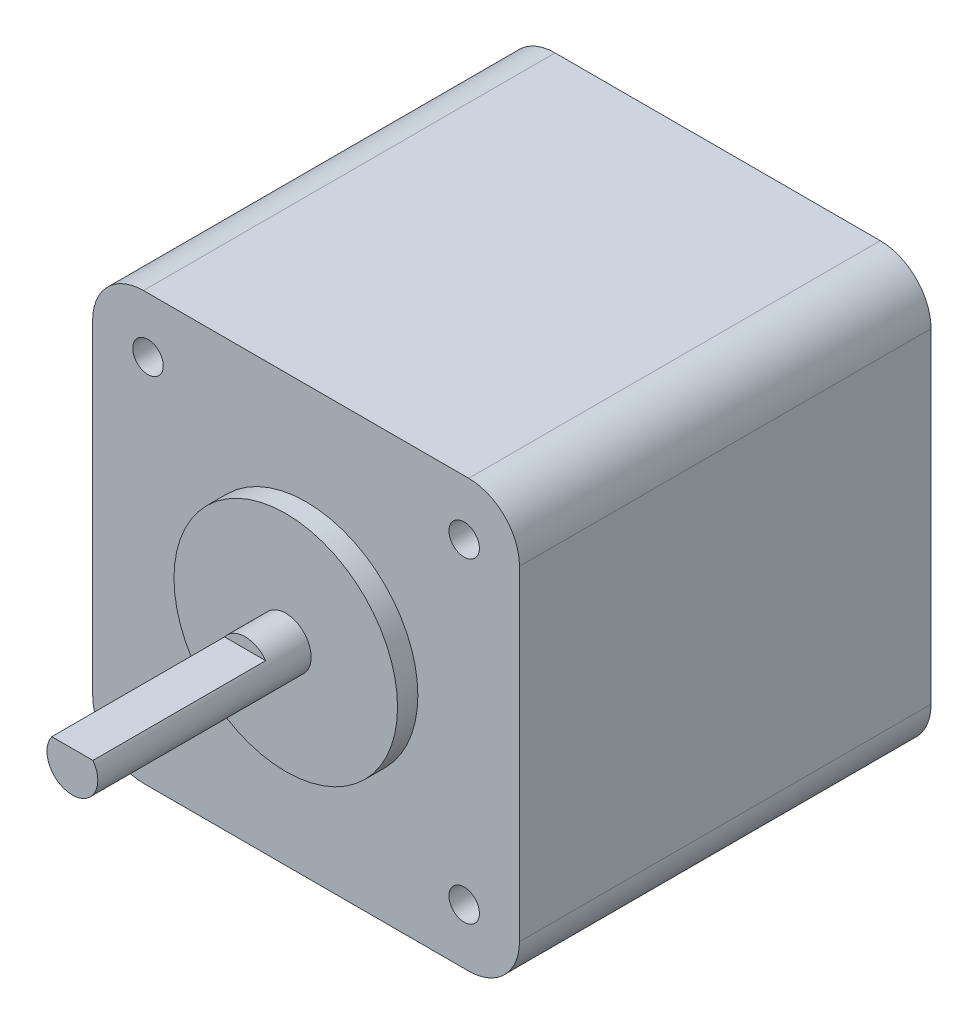
from build123d import *

# Parameters (mm, degrees)
SKETCH1_W           = 42
SKETCH1_H           = 42
BOSS_EXTRUDE1_DEPTH = 40.5
SKETCH2_R           = 11
BOSS_EXTRUDE2_DEPTH = 2
SKETCH3_R           = 2.5
BOSS_EXTRUDE3_DEPTH = 21
FILLET1_R           = 5
SKETCH4_R           = 1.5
CUT_EXTRUDE1_DEPTH  = 10
CUT_EXTRUDE2_START  = -17
CUT_EXTRUDE2_DEPTH  = 17


with BuildPart() as part:
    # Sketch1 → Boss-Extrude1 (new body)
    with BuildSketch(Plane.XY):
        Rectangle(SKETCH1_W, SKETCH1_H)
    extrude(amount=BOSS_EXTRUDE1_DEPTH)

    # Sketch2 → Boss-Extrude2 (add)
    with BuildSketch(Plane.XY.offset(40.5)):
        with Locations(Location((0, 0, 0), (0, 0, 180))):
            Circle(SKETCH2_R)
    extrude(amount=BOSS_EXTRUDE2_DEPTH)

    # Sketch3 → Boss-Extrude3 (add)
    with BuildSketch(Plane.XY.offset(42.5)):
        with Locations(Location((0, 0, 0), (0, 0, 180))):
            Circle(SKETCH3_R)
    extrude(amount=BOSS_EXTRUDE3_DEPTH)

    # Fillet1
    fillet1_edges = [part.edges().sort_by_distance(p)[0] for p in [
        (21, -21, 20.25),
        (-21, -21, 20.25),
        (-21, 21, 20.25),
        (21, 21, 20.25),
    ]]
    fillet(fillet1_edges, radius=FILLET1_R)

    # Sketch4 → Cut-Extrude1 (cut)
    with BuildSketch(Plane.XY.offset(40.5)):
        with Locations((15.556349186, 15.556349186)):
            Circle(SKETCH4_R)
        with Locations((-15.556349186, -15.556349186)):
            Circle(SKETCH4_R)
        with Locations((15.556349186, -15.556349186)):
            Circle(SKETCH4_R)
        with Locations((-15.556349186, 15.556349186)):
            Circle(SKETCH4_R)
    extrude(amount=-CUT_EXTRUDE1_DEPTH, mode=Mode.SUBTRACT)

    # Sketch5 → Cut-Extrude2 (cut)
    with BuildSketch(Plane.XY.offset(63.5).offset(CUT_EXTRUDE2_START)):
        with BuildLine():
            Line((-2.024666714, 1.466534929), (2.024666714, 1.466534929))
            ThreePointArc((2.024666714, 1.466534929), (0, 2.5), (-2.024666714, 1.466534929))
        make_face()
    extrude(amount=CUT_EXTRUDE2_DEPTH, mode=Mode.SUBTRACT)


solid = part.part
